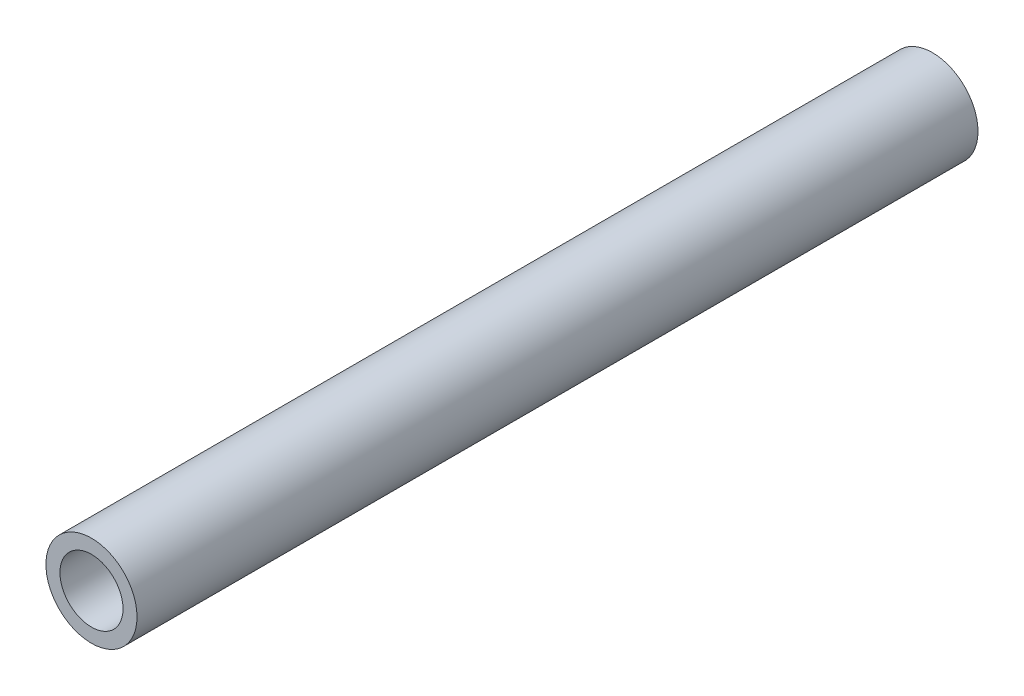
from build123d import *

# Parameters (mm, degrees)
SKETCH1_R           = 6.5
SKETCH1_R_2         = 4.5
BOSS_EXTRUDE1_DEPTH = 120


with BuildPart() as part:
    # Sketch1 → Boss-Extrude1 (new body)
    with BuildSketch(Plane.XY):
        Circle(SKETCH1_R)
        Circle(SKETCH1_R_2, mode=Mode.SUBTRACT)
    extrude(amount=BOSS_EXTRUDE1_DEPTH)


solid = part.part
